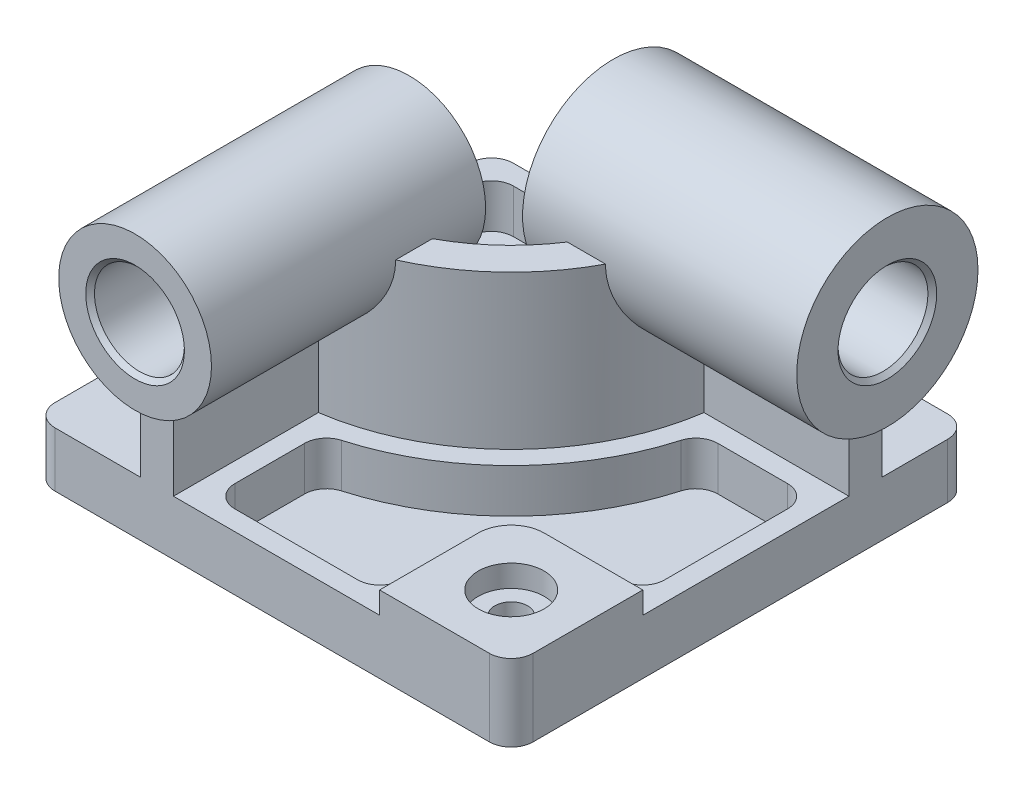
from build123d import *

# Parameters (mm, degrees)
BOSS_EXTRUDE1_DEPTH                     = 25
BOSS_EXTRUDE2_START                     = -25
BOSS_EXTRUDE2_DEPTH                     = 95
BOSS_EXTRUDE3_DEPTH                     = 10
CBORE_FOR_M8_HEX_HEAD_BOLT1_D           = 15
CBORE_FOR_M8_HEX_HEAD_BOLT1_CBORE_D     = 30
CBORE_FOR_M8_HEX_HEAD_BOLT1_CBORE_DEPTH = 10
CUT_EXTRUDE1_DEPTH                      = 20
BOSS_EXTRUDE4_START                     = 10
SKETCH7_R                               = 34.833333333
BOSS_EXTRUDE4_DEPTH                     = 125
BOSS_EXTRUDE5_START                     = 10
SKETCH8_R                               = 41.333333333
BOSS_EXTRUDE5_DEPTH                     = 125
CUT_EXTRUDE2_REACH                      = 315.988
SKETCH9_R                               = 20.5
CUT_EXTRUDE3_REACH                      = 322.331
SKETCH10_R                              = 20.5
CHAMFER1_SIZE                           = 2
CUT_EXTRUDE4_DEPTH                      = 20
FILLET1_R                               = 10


with BuildPart() as part:
    # Sketch1 → Boss-Extrude1 (new body)
    with BuildSketch(Plane(origin=(0, 0, 0), x_dir=(1, 0, 0), z_dir=(0, 1, 0))):
        with BuildLine():
            Line((-39, 40), (159, 40))
            ThreePointArc((159, 40), (166.071067812, 37.071067812), (169, 30))
            Line((169, 30), (169, -159))
            ThreePointArc((169, -159), (166.071067812, -166.071067812), (159, -169))
            Line((159, -169), (-39, -169))
            ThreePointArc((-39, -169), (-46.071067812, -166.071067812), (-49, -159))
            Line((-49, -159), (-49, 30))
            ThreePointArc((-49, 30), (-46.071067812, 37.071067812), (-39, 40))
        make_face()
    extrude(amount=BOSS_EXTRUDE1_DEPTH)

    # Sketch2 → Boss-Extrude2 (add)
    with BuildSketch(Plane(origin=(0, 25, 0), x_dir=(1, 0, 0), z_dir=(0, 1, 0)).offset(BOSS_EXTRUDE2_START)):
        with BuildLine():
            Line((0, -89), (0, -169))
            Line((0, -169), (15, -169))
            Line((15, -169), (15, -102.912584265))
            ThreePointArc((15, -102.912584265), (73.539105243, -73.539105243), (102.912584265, -15))
            Line((102.912584265, -15), (169, -15))
            Line((169, -15), (169, 0))
            Line((169, 0), (89, 0))
            ThreePointArc((89, 0), (62.932503526, -62.932503526), (0, -89))
        make_face()
    extrude(amount=BOSS_EXTRUDE2_DEPTH)

    # Sketch3 → Boss-Extrude3 (add)
    with BuildSketch(Plane(origin=(0, 25, 0), x_dir=(1, 0, 0), z_dir=(0, 1, 0))):
        with BuildLine():
            Line((124, -109), (169, -109))
            Line((169, -109), (169, -159))
            ThreePointArc((169, -159), (166.071067812, -166.071067812), (159, -169))
            Line((159, -169), (109, -169))
            Line((109, -169), (109, -124))
            ThreePointArc((109, -124), (113.393398282, -113.393398282), (124, -109))
        make_face()
    extrude(amount=BOSS_EXTRUDE3_DEPTH)

    # CBORE for M8 Hex Head Bolt1 (through all)
    with Locations(Plane(origin=(0, 35, 0), x_dir=(1, 0, 0), z_dir=(0, 1, 0))):
        with Locations((139, -139)):
            CounterBoreHole(CBORE_FOR_M8_HEX_HEAD_BOLT1_D / 2, CBORE_FOR_M8_HEX_HEAD_BOLT1_CBORE_D / 2, CBORE_FOR_M8_HEX_HEAD_BOLT1_CBORE_DEPTH)

    # Sketch6 → Cut-Extrude1 (cut)
    with BuildSketch(Plane(origin=(0, 25, 0), x_dir=(1, 0, 0), z_dir=(0, 1, 0))):
        with BuildLine():
            Line((100, -150), (100, -124))
            ThreePointArc((100, -124), (107.029437252, -107.029437252), (124, -100))
            Line((124, -100), (150, -100))
            ThreePointArc((150, -100), (157.071067812, -97.071067812), (160, -90))
            Line((160, -90), (160, -34))
            ThreePointArc((160, -34), (157.071067812, -26.928932188), (150, -24))
            Line((150, -24), (118.207444774, -24))
            ThreePointArc((118.207444774, -24), (112.192558093, -26.011186683), (108.59708341, -31.235772358))
            ThreePointArc((108.59708341, -31.235772358), (79.903066274, -79.903066274), (31.235772358, -108.59708341))
            ThreePointArc((31.235772358, -108.59708341), (26.011186683, -112.192558093), (24, -118.207444774))
            Line((24, -118.207444774), (24, -150))
            ThreePointArc((24, -150), (26.928932188, -157.071067812), (34, -160))
            Line((34, -160), (90, -160))
            ThreePointArc((90, -160), (97.071067812, -157.071067812), (100, -150))
        make_face()
    extrude(amount=-CUT_EXTRUDE1_DEPTH, mode=Mode.SUBTRACT)

    # Sketch7 → Boss-Extrude4 (add)
    with BuildSketch(Plane.XY.offset(169).offset(BOSS_EXTRUDE4_START)):
        with Locations((7.5, 95)):
            Circle(SKETCH7_R)
    extrude(amount=-BOSS_EXTRUDE4_DEPTH)

    # Sketch8 → Boss-Extrude5 (add)
    with BuildSketch(Plane(origin=(169, 0, 0), x_dir=(0, 0, -1), z_dir=(1, 0, 0)).offset(BOSS_EXTRUDE5_START)):
        with Locations((-7.5, 95)):
            Circle(SKETCH8_R)
    extrude(amount=-BOSS_EXTRUDE5_DEPTH)

    # Sketch9 → Cut-Extrude2 (cut, up to next)
    with BuildSketch(Plane.XY.offset(179), mode=Mode.PRIVATE) as cut_extrude2_sk1:
        with Locations((7.5, 95)):
            Circle(SKETCH9_R)
    cut_extrude2_tool1 = extrude(cut_extrude2_sk1.sketch, amount=-CUT_EXTRUDE2_REACH, mode=Mode.PRIVATE) & part.part
    add(cut_extrude2_tool1.solids().sort_by_distance((7.5, 95, 179))[0], mode=Mode.SUBTRACT)

    # Sketch10 → Cut-Extrude3 (cut, up to next)
    with BuildSketch(Plane(origin=(179, 0, 0), x_dir=(0, 0, -1), z_dir=(1, 0, 0)), mode=Mode.PRIVATE) as cut_extrude3_sk1:
        with Locations((-7.5, 95)):
            Circle(SKETCH10_R)
    cut_extrude3_tool1 = extrude(cut_extrude3_sk1.sketch, amount=-CUT_EXTRUDE3_REACH, mode=Mode.PRIVATE) & part.part
    add(cut_extrude3_tool1.solids().sort_by_distance((179, 95, 7.5))[0], mode=Mode.SUBTRACT)

    # Chamfer1
    chamfer1_edges = [part.edges().sort_by_distance(p)[0] for p in [
        (-13, 95, 179),
        (-13, 95, 54),
        (179, 95, 28),
        (54, 95, 28),
    ]]
    chamfer(chamfer1_edges, length=CHAMFER1_SIZE)

    # Sketch11 → Cut-Extrude4 (cut)
    with BuildSketch(Plane(origin=(0, 25, 0), x_dir=(1, 0, 0), z_dir=(0, 1, 0))):
        with BuildLine():
            Line((0, -80), (-40, -80))
            Line((-40, -80), (-40, 30))
            Line((-40, 30), (-40, 31))
            Line((-40, 31), (-39, 31))
            Line((-39, 31), (80, 31))
            Line((80, 31), (80, 0))
            ThreePointArc((80, 0), (56.568542495, -56.568542495), (0, -80))
        make_face()
    extrude(amount=-CUT_EXTRUDE4_DEPTH, mode=Mode.SUBTRACT)

    # Fillet1
    fillet1_edges = [part.edges().sort_by_distance(p)[0] for p in [
        (-40, 15, 80),
        (-40, 15, -31),
        (80, 15, -31),
    ]]
    fillet(fillet1_edges, radius=FILLET1_R)


solid = part.part
